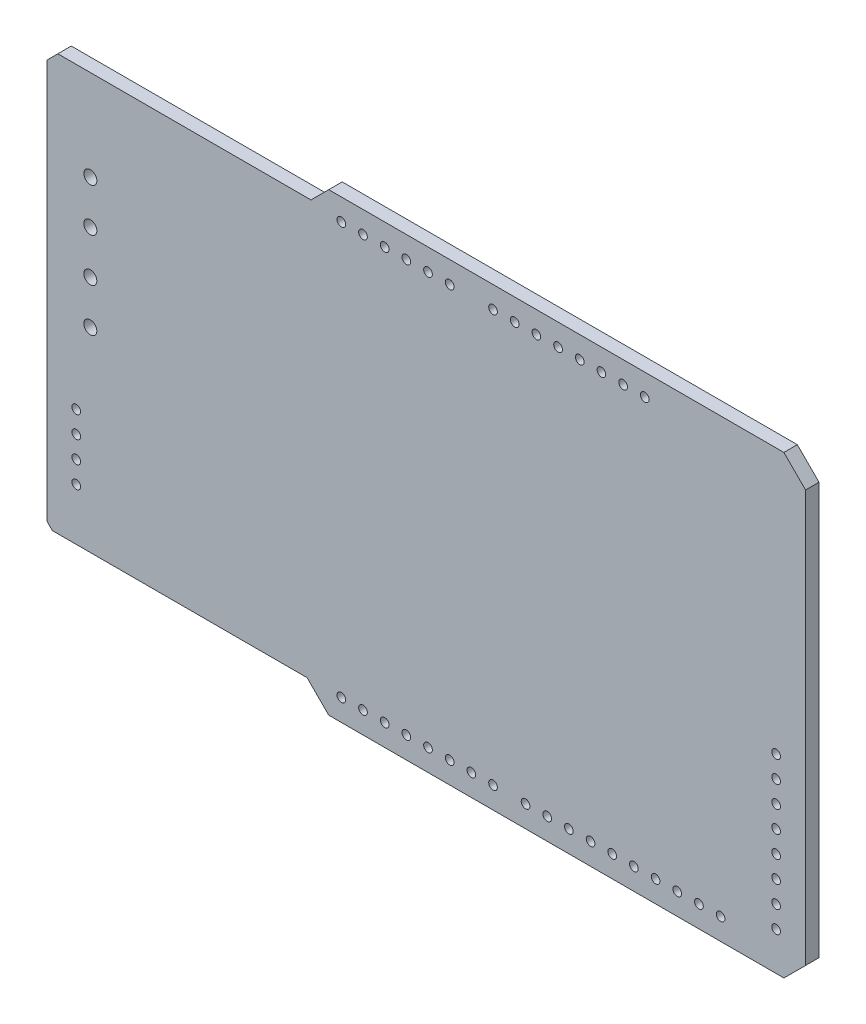
from build123d import *

# Parameters (mm, degrees)
BOSS_EXTRUDE1_DEPTH = 1.5748
SKETCH2_R           = 0.508
SKETCH2_R_2         = 0.762
CUT_EXTRUDE1_DEPTH  = 104.686284508


with BuildPart() as part:
    # Sketch1 → Boss-Extrude1 (new body)
    with BuildSketch(Plane.XY):
        Polygon((0, 49.9872), (1.27, 51.2572), (30.9372, 51.2572), (33.02, 53.34), (86.36, 53.34), (88.9, 50.8), (88.9, 2.54), (86.36, 0), (33.02, 0), (30.48, 2.54), (0.635, 2.54), (0, 3.175), align=None)
    extrude(amount=BOSS_EXTRUDE1_DEPTH)

    # Sketch2 → Cut-Extrude1 (cut, through all)
    with BuildSketch(Plane.XY.offset(1.5748)):
        with Locations((3.429, 8.636)):
            Circle(SKETCH2_R)
        with Locations((3.429, 11.176)):
            Circle(SKETCH2_R)
        with Locations((3.429, 13.716)):
            Circle(SKETCH2_R)
        with Locations((3.429, 16.256)):
            Circle(SKETCH2_R)
        with Locations((5.08, 25.4)):
            Circle(SKETCH2_R_2)
        with Locations((5.08, 30.48)):
            Circle(SKETCH2_R_2)
        with Locations((5.08, 35.56)):
            Circle(SKETCH2_R_2)
        with Locations((5.08, 40.64)):
            Circle(SKETCH2_R_2)
        with Locations((85.4456, 4.4958)):
            Circle(SKETCH2_R)
        with Locations((85.4456, 7.0358)):
            Circle(SKETCH2_R)
        with Locations((85.4456, 9.5758)):
            Circle(SKETCH2_R)
        with Locations((85.4456, 12.1158)):
            Circle(SKETCH2_R)
        with Locations((85.4456, 14.6558)):
            Circle(SKETCH2_R)
        with Locations((85.4456, 17.1958)):
            Circle(SKETCH2_R)
        with Locations((85.4456, 19.7358)):
            Circle(SKETCH2_R)
        with Locations((85.4456, 22.2758)):
            Circle(SKETCH2_R)
        with Locations((34.4932, 50.8)):
            Circle(SKETCH2_R)
        with Locations((37.0332, 50.8)):
            Circle(SKETCH2_R)
        with Locations((39.5732, 50.8)):
            Circle(SKETCH2_R)
        with Locations((42.1132, 50.8)):
            Circle(SKETCH2_R)
        with Locations((44.6532, 50.8)):
            Circle(SKETCH2_R)
        with Locations((47.1932, 50.8)):
            Circle(SKETCH2_R)
        with Locations((52.2732, 50.8)):
            Circle(SKETCH2_R)
        with Locations((54.8132, 50.8)):
            Circle(SKETCH2_R)
        with Locations((57.3532, 50.8)):
            Circle(SKETCH2_R)
        with Locations((59.8932, 50.8)):
            Circle(SKETCH2_R)
        with Locations((62.4332, 50.8)):
            Circle(SKETCH2_R)
        with Locations((64.9732, 50.8)):
            Circle(SKETCH2_R)
        with Locations((67.5132, 50.8)):
            Circle(SKETCH2_R)
        with Locations((70.0532, 50.8)):
            Circle(SKETCH2_R)
        with Locations((34.4932, 2.54)):
            Circle(SKETCH2_R)
        with Locations((37.0332, 2.54)):
            Circle(SKETCH2_R)
        with Locations((39.5732, 2.54)):
            Circle(SKETCH2_R)
        with Locations((42.1132, 2.54)):
            Circle(SKETCH2_R)
        with Locations((44.6532, 2.54)):
            Circle(SKETCH2_R)
        with Locations((47.1932, 2.54)):
            Circle(SKETCH2_R)
        with Locations((49.7332, 2.54)):
            Circle(SKETCH2_R)
        with Locations((52.2732, 2.54)):
            Circle(SKETCH2_R)
        with Locations((56.0832, 2.54)):
            Circle(SKETCH2_R)
        with Locations((58.6232, 2.54)):
            Circle(SKETCH2_R)
        with Locations((61.1632, 2.54)):
            Circle(SKETCH2_R)
        with Locations((63.7032, 2.54)):
            Circle(SKETCH2_R)
        with Locations((66.2432, 2.54)):
            Circle(SKETCH2_R)
        with Locations((68.7832, 2.54)):
            Circle(SKETCH2_R)
        with Locations((71.3232, 2.54)):
            Circle(SKETCH2_R)
        with Locations((73.8632, 2.54)):
            Circle(SKETCH2_R)
        with Locations((76.4032, 2.54)):
            Circle(SKETCH2_R)
        with Locations((78.9432, 2.54)):
            Circle(SKETCH2_R)
    extrude(amount=-CUT_EXTRUDE1_DEPTH, mode=Mode.SUBTRACT)


solid = part.part
